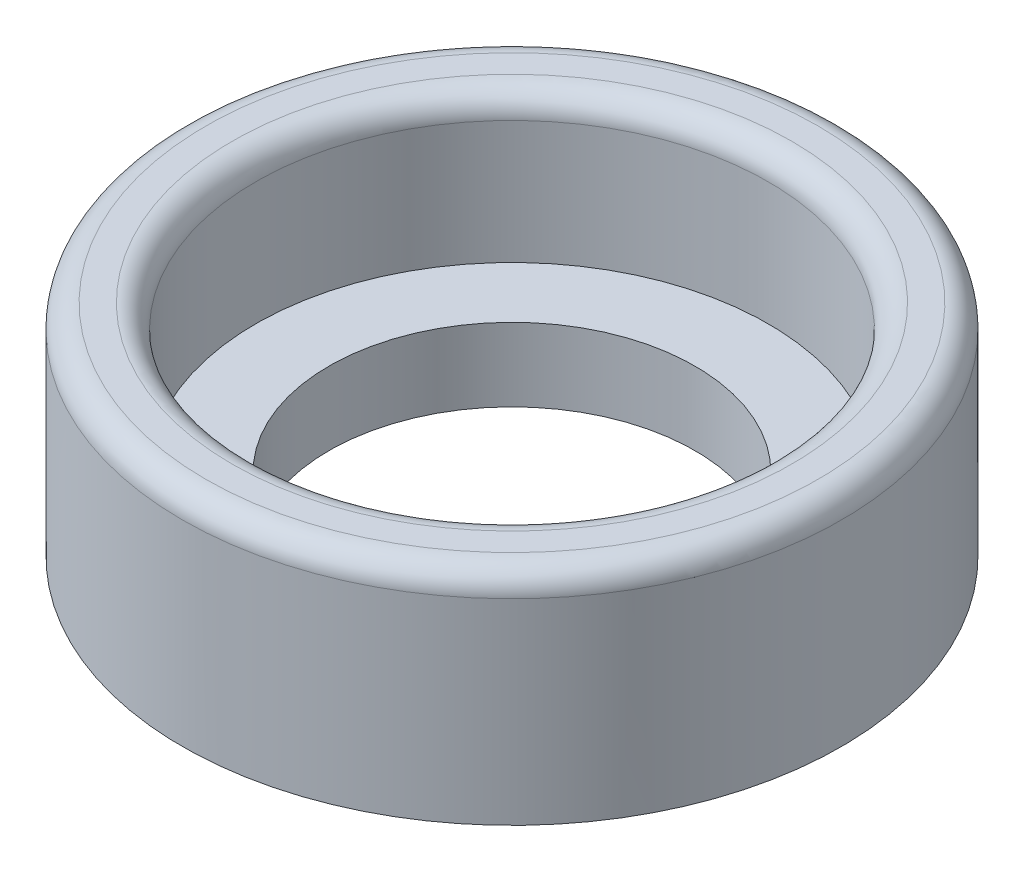
from build123d import *

# Parameters (mm, degrees)
SKETCH1_R                                           = 7.14375
BOSS_EXTRUDE1_DEPTH                                 = 4.7625
CBORE_FOR_00_BINDING_HEAD_MACHINE_SCREW_D           = 7.9375
CBORE_FOR_00_BINDING_HEAD_MACHINE_SCREW_CBORE_D     = 11.1125
CBORE_FOR_00_BINDING_HEAD_MACHINE_SCREW_CBORE_DEPTH = 3.175
FILLET2_R                                           = 0.508


with BuildPart() as part:
    # Sketch1 → Boss-Extrude1 (new body)
    with BuildSketch(Plane(origin=(0, 0, 0), x_dir=(1, 0, 0), z_dir=(0, 1, 0))):
        Circle(SKETCH1_R)
    extrude(amount=BOSS_EXTRUDE1_DEPTH)

    # CBORE for #00 Binding Head Machine Screw1 (through all)
    with Locations(Plane(origin=(0, 4.7625, 0), x_dir=(1, 0, 0), z_dir=(0, 1, 0))):
        with Locations((0, 0)):
            CounterBoreHole(CBORE_FOR_00_BINDING_HEAD_MACHINE_SCREW_D / 2, CBORE_FOR_00_BINDING_HEAD_MACHINE_SCREW_CBORE_D / 2, CBORE_FOR_00_BINDING_HEAD_MACHINE_SCREW_CBORE_DEPTH)

    # Fillet2
    fillet2_edges = [part.edges().sort_by_distance(p)[0] for p in [
        (-7.14375, 4.7625, 0),
        (-5.55625, 4.7625, 0),
    ]]
    fillet(fillet2_edges, radius=FILLET2_R)


solid = part.part
